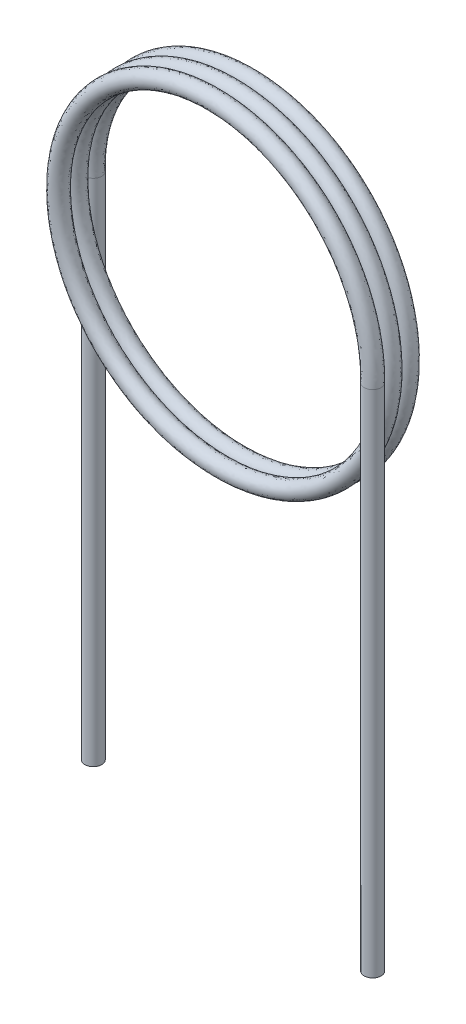
from build123d import *

# Parameters (mm, degrees)
SWEEP1_PITCH                 = 0.51
SWEEP1_HEIGHT                = 1.275
SWEEP1_RADIUS                = 4.75
SWEEP1_START_ANGLE           = -180
SCHIZZO2_R                   = 0.25
SCHIZZO3_R                   = 0.25
ESTRUSIONE_ESTRUSIONE1_DEPTH = 15


with BuildPart() as part:
    # Sweep1: sweep along a helix
    with BuildLine() as sweep1_path:
        add(Helix(SWEEP1_PITCH, SWEEP1_HEIGHT, SWEEP1_RADIUS, center=(0, 0, 0), direction=(0, 0, 1), lefthand=True, mode=Mode.PRIVATE).rotate(Axis((0, 0, 0), (0, 0, 1)), SWEEP1_START_ANGLE))
    # Schizzo2 → Sweep1 (sweep)
    with BuildSketch(Plane(origin=(0, 0, 0), x_dir=(1, 0, 0), z_dir=(0, 1, 0))):
        with Locations((-4.75, 0)):
            Circle(SCHIZZO2_R)
    sweep(path=sweep1_path.line, is_frenet=True)

    # Schizzo3 → Estrusione-Estrusione1 (add)
    with BuildSketch(Plane(origin=(0, 0, 0), x_dir=(1, 0, 0), z_dir=(0, 1, 0))):
        with Locations(Location((4.75, -1.275, 0), (0, 0, 270))):
            Circle(SCHIZZO3_R)
        with Locations(Location((-4.75, 0, 0), (0, 0, 270))):
            Circle(SCHIZZO3_R)
    extrude(amount=-ESTRUSIONE_ESTRUSIONE1_DEPTH)


solid = part.part
